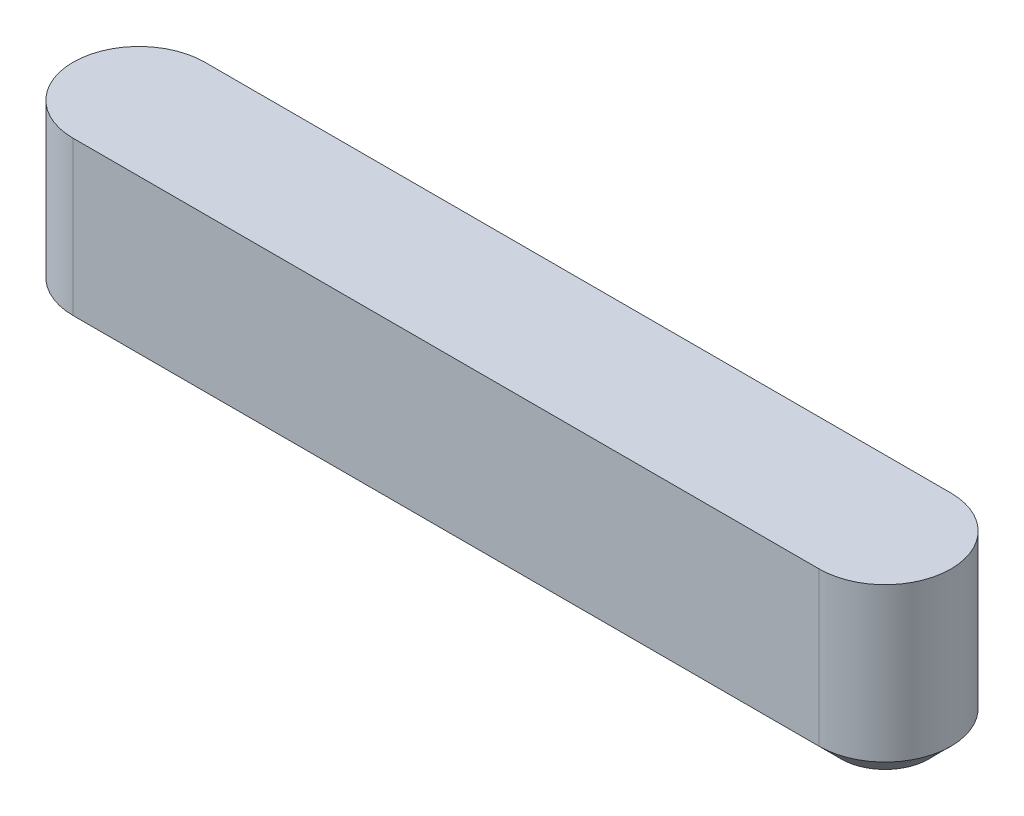
from build123d import *

# Parameters (mm, degrees)
EXTRUDE_1_DEPTH = 4
CHAMFER_1_SIZE  = 0.5


with BuildPart() as part:
    # 草图1 → 凸台-拉伸1 (new body)
    with BuildSketch(Plane(origin=(0, 0, 0), x_dir=(1, 0, 0), z_dir=(0, 1, 0))):
        with BuildLine():
            Line((-8.5, -1.5), (8.5, -1.5))
            ThreePointArc((8.5, -1.5), (10, 0), (8.5, 1.5))
            Line((8.5, 1.5), (-8.5, 1.5))
            ThreePointArc((-8.5, 1.5), (-10, 0), (-8.5, -1.5))
        make_face()
    extrude(amount=EXTRUDE_1_DEPTH)

    # 倒角1
    chamfer_1_edges = [part.edges().sort_by_distance(p)[0] for p in [
        (0, 0, 1.5),
        (-10, 0, 0),
        (0, 0, -1.5),
        (10, 0, 0),
    ]]
    chamfer(chamfer_1_edges, length=CHAMFER_1_SIZE)


solid = part.part
